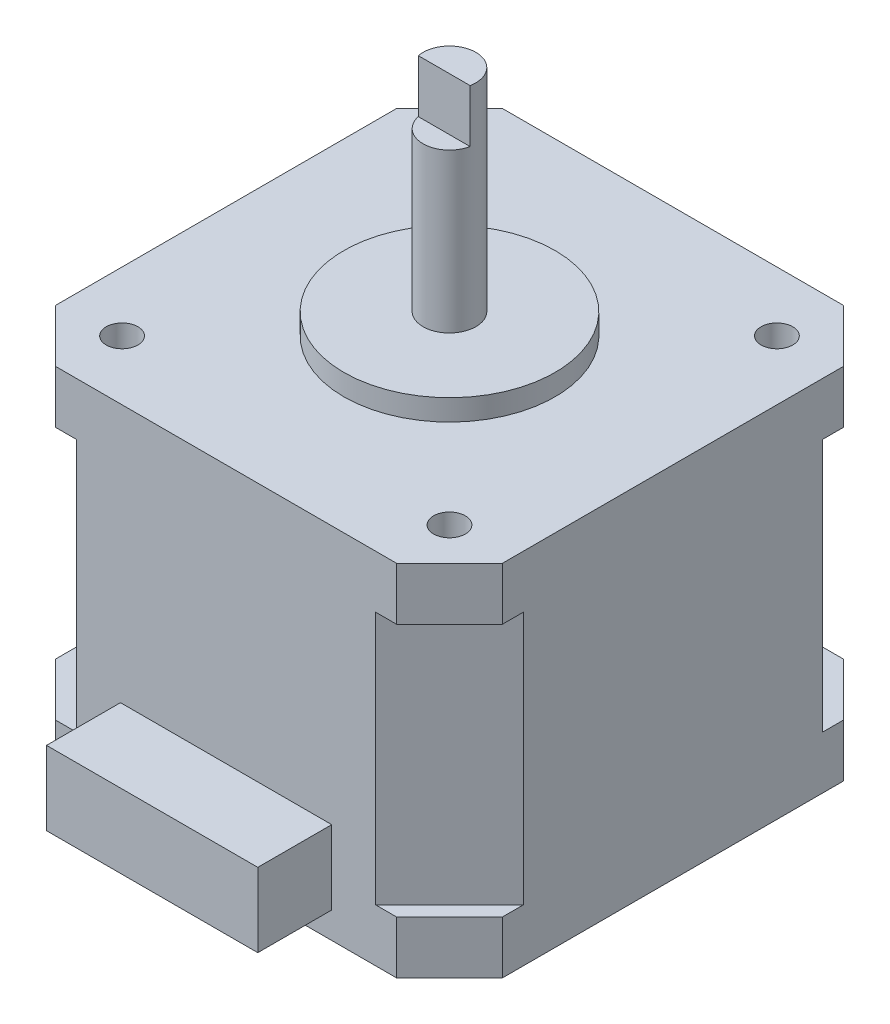
from build123d import *

# Parameters (mm, degrees)
SKETCH1_W           = 42.3
SKETCH1_H           = 42.3
BOSS_EXTRUDE1_DEPTH = 5
CHAMFER1_SIZE       = 5
BOSS_EXTRUDE2_DEPTH = 24
SKETCH3_W           = 42.3
SKETCH3_H           = 42.3
BOSS_EXTRUDE3_DEPTH = 5
CHAMFER2_SIZE       = 5
SKETCH4_R           = 10
BOSS_EXTRUDE4_DEPTH = 2
SKETCH5_W           = 20
SKETCH5_H           = 7
BOSS_EXTRUDE5_DEPTH = 7
SKETCH6_R           = 2.5
BOSS_EXTRUDE6_DEPTH = 20
CUT_EXTRUDE1_START  = -5
CUT_EXTRUDE1_DEPTH  = 5
SKETCH8_R           = 1.5
CUT_EXTRUDE2_DEPTH  = 5


with BuildPart() as part:
    # Sketch1 → Boss-Extrude1 (new body)
    with BuildSketch(Plane(origin=(0, 0, 0), x_dir=(1, 0, 0), z_dir=(0, 1, 0))):
        Rectangle(SKETCH1_W, SKETCH1_H)
    extrude(amount=BOSS_EXTRUDE1_DEPTH)

    # Chamfer1
    chamfer1_edges = [part.edges().sort_by_distance(p)[0] for p in [
        (21.15, 2.5, 21.15),
        (-21.15, 2.5, 21.15),
        (-21.15, 2.5, -21.15),
        (21.15, 2.5, -21.15),
    ]]
    chamfer(chamfer1_edges, length=CHAMFER1_SIZE)

    # Sketch2 → Boss-Extrude2 (add)
    with BuildSketch(Plane(origin=(0, 5, 0), x_dir=(1, 0, 0), z_dir=(0, 1, 0))):
        Polygon((-21.15, 14.15), (-14.15, 21.15), (14.15, 21.15), (21.15, 14.15), (21.15, -14.15), (14.15, -21.15), (-14.15, -21.15), (-21.15, -14.15), align=None)
    extrude(amount=BOSS_EXTRUDE2_DEPTH)

    # Sketch3 → Boss-Extrude3 (add)
    with BuildSketch(Plane(origin=(0, 29, 0), x_dir=(1, 0, 0), z_dir=(0, 1, 0))):
        Rectangle(SKETCH3_W, SKETCH3_H)
    extrude(amount=BOSS_EXTRUDE3_DEPTH)

    # Chamfer2
    chamfer2_edges = [part.edges().sort_by_distance(p)[0] for p in [
        (21.15, 31.5, 21.15),
        (21.15, 31.5, -21.15),
        (-21.15, 31.5, -21.15),
        (-21.15, 31.5, 21.15),
    ]]
    chamfer(chamfer2_edges, length=CHAMFER2_SIZE)

    # Sketch4 → Boss-Extrude4 (add)
    with BuildSketch(Plane(origin=(0, 34, 0), x_dir=(1, 0, 0), z_dir=(0, 1, 0))):
        with Locations(Location((0, 0, 0), (0, 0, 270))):
            Circle(SKETCH4_R)
    extrude(amount=BOSS_EXTRUDE4_DEPTH)

    # Sketch5 → Boss-Extrude5 (add)
    with BuildSketch(Plane.XY.offset(21.15)):
        with Locations((0, 6)):
            Rectangle(SKETCH5_W, SKETCH5_H)
    extrude(amount=BOSS_EXTRUDE5_DEPTH)

    # Sketch6 → Boss-Extrude6 (add)
    with BuildSketch(Plane(origin=(0, 36, 0), x_dir=(1, 0, 0), z_dir=(0, 1, 0))):
        with Locations(Location((0, 0, 0), (0, 0, 270))):
            Circle(SKETCH6_R)
    extrude(amount=BOSS_EXTRUDE6_DEPTH)

    # Sketch7 → Cut-Extrude1 (cut)
    with BuildSketch(Plane(origin=(0, 56, 0), x_dir=(1, 0, 0), z_dir=(0, 1, 0)).offset(CUT_EXTRUDE1_START)):
        with BuildLine():
            Line((-2.449489743, -0.5), (2.449489743, -0.5))
            ThreePointArc((2.449489743, -0.5), (0, -2.5), (-2.449489743, -0.5))
        make_face()
    extrude(amount=CUT_EXTRUDE1_DEPTH, mode=Mode.SUBTRACT)

    # Sketch8 → Cut-Extrude2 (cut)
    with BuildSketch(Plane(origin=(0, 34, 0), x_dir=(1, 0, 0), z_dir=(0, 1, 0))):
        with Locations(Location((-15.5, 15.5, 0), (0, 0, 270))):
            Circle(SKETCH8_R)
        with Locations(Location((15.5, 15.5, 0), (0, 0, 270))):
            Circle(SKETCH8_R)
        with Locations(Location((15.5, -15.5, 0), (0, 0, 270))):
            Circle(SKETCH8_R)
        with Locations(Location((-15.5, -15.5, 0), (0, 0, 270))):
            Circle(SKETCH8_R)
    extrude(amount=-CUT_EXTRUDE2_DEPTH, mode=Mode.SUBTRACT)


solid = part.part
